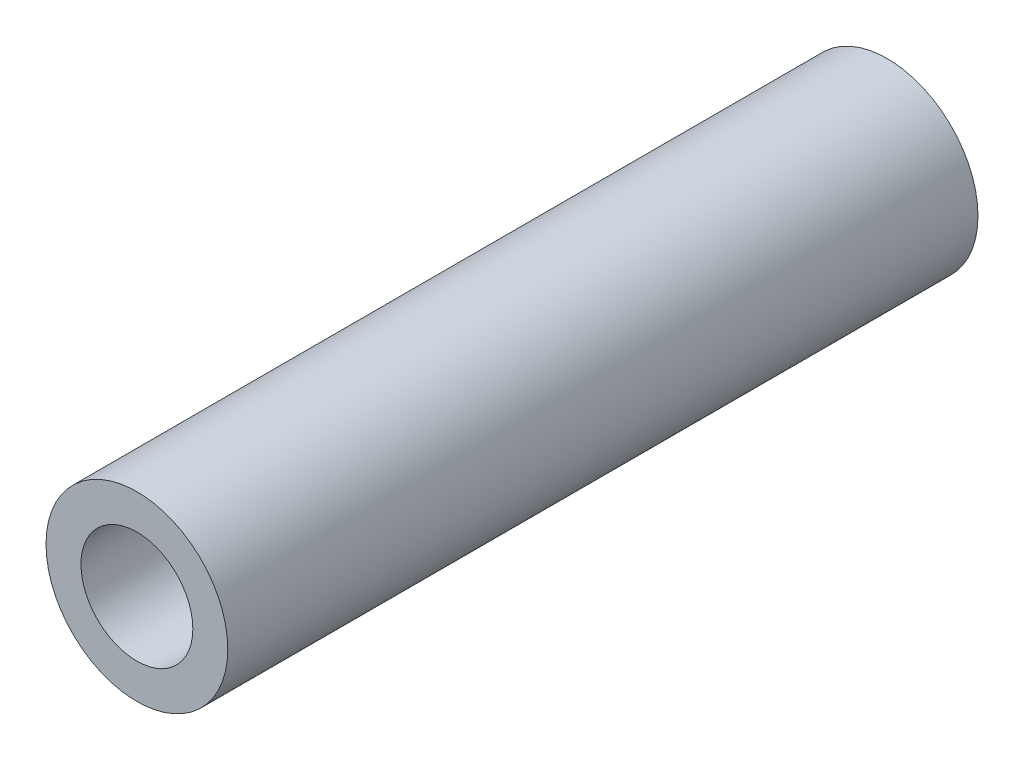
from build123d import *

# Parameters (mm, degrees)
SKETCH1_R           = 6.5
SKETCH1_R_2         = 4
BOSS_EXTRUDE1_DEPTH = 53.65


with BuildPart() as part:
    # Sketch1 → Boss-Extrude1 (new body)
    with BuildSketch(Plane.XY):
        with Locations((106.653543307, 0)):
            Circle(SKETCH1_R)
        with Locations((106.653543307, 0)):
            Circle(SKETCH1_R_2, mode=Mode.SUBTRACT)
    extrude(amount=BOSS_EXTRUDE1_DEPTH)


solid = part.part
